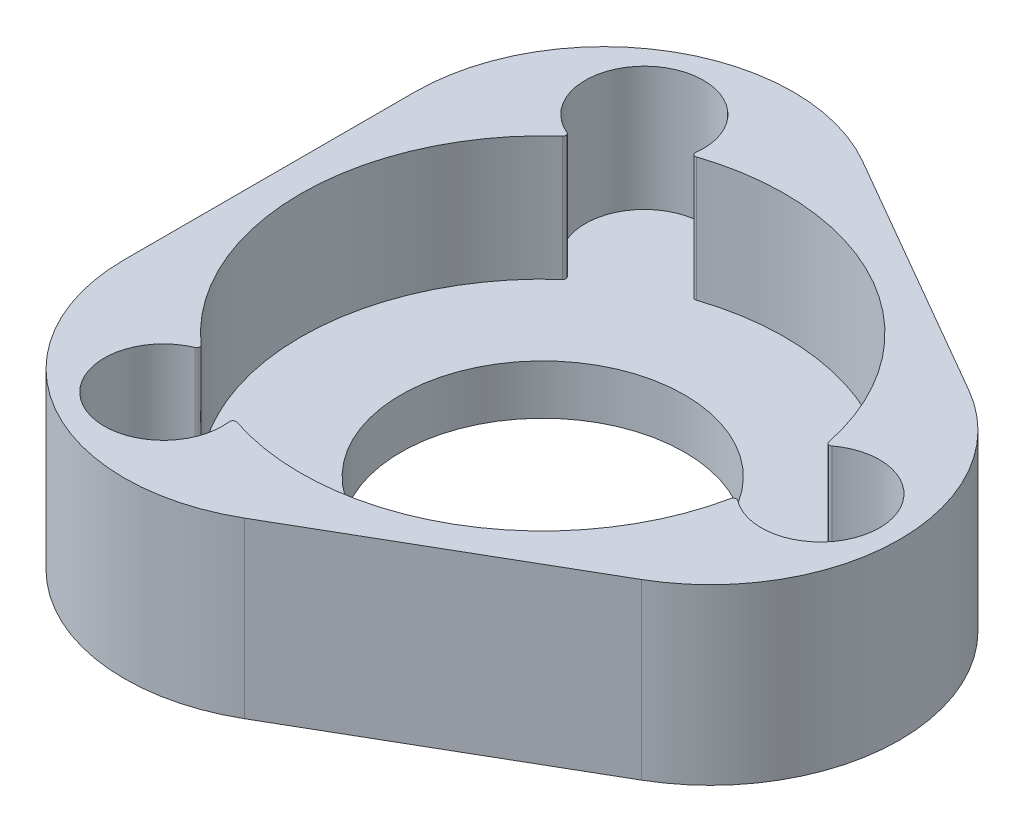
from build123d import *

# Parameters (mm, degrees)
BOSS_EXTRUDE15_DEPTH = 7
CUT_EXTRUDE1_DEPTH   = 5
SKETCH9_R            = 5.715
CUT_EXTRUDE2_DEPTH   = 5


with BuildPart() as part:
    # Sketch7 → Boss-Extrude15 (new body)
    with BuildSketch(Plane(origin=(0, 0, 0), x_dir=(1, 0, 0), z_dir=(0, 1, 0))):
        with BuildLine():
            Line((10.57, 6.599113577), (0.43, 12.453445306))
            ThreePointArc((0.43, 12.453445306), (-7.19, 12.453445306), (-11, 5.85433173))
            Line((-11, 5.85433173), (-11, -5.85433173))
            ThreePointArc((-11, -5.85433173), (-7.19, -12.453445306), (0.43, -12.453445306))
            Line((0.43, -12.453445306), (10.57, -6.599113577))
            ThreePointArc((10.57, -6.599113577), (14.38, 0), (10.57, 6.599113577))
        make_face()
    extrude(amount=BOSS_EXTRUDE15_DEPTH)

    # Sketch8 → Cut-Extrude1 (cut)
    with BuildSketch(Plane(origin=(0, 7, 0), x_dir=(1, 0, 0), z_dir=(0, 1, 0))):
        with BuildLine():
            ThreePointArc((-6.482578701, -7.282765504), (-6.441733645, -7.398430092), (-6.51776578, -7.494688754))
            ThreePointArc((-6.51776578, -7.494688754), (-7.970853819, -9.540441946), (-6.784903319, -11.751797273))
            ThreePointArc((-6.784903319, -11.751797273), (-4.276838179, -11.67318287), (-3.231707964, -9.391895118))
            ThreePointArc((-3.231707964, -9.391895118), (-3.186361585, -9.277920027), (-3.065770585, -9.255460589))
            ThreePointArc((-3.065770585, -9.255460589), (4.875, -8.443747687), (9.548349287, -1.972695086))
            ThreePointArc((9.548349287, -1.972695086), (9.62809523, -1.879489935), (9.749473744, -1.897206364))
            ThreePointArc((9.749473744, -1.897206364), (12.247691998, -2.132740924), (13.569806638, 0))
            ThreePointArc((13.569806638, 0), (12.247691998, 2.132740924), (9.749473744, 1.897206364))
            ThreePointArc((9.749473744, 1.897206364), (9.62809523, 1.879489935), (9.548349287, 1.972695086))
            ThreePointArc((9.548349287, 1.972695086), (4.875, 8.443747687), (-3.065770585, 9.255460589))
            ThreePointArc((-3.065770585, 9.255460589), (-3.186361585, 9.277920027), (-3.231707964, 9.391895118))
            ThreePointArc((-3.231707964, 9.391895118), (-4.276838179, 11.67318287), (-6.784903319, 11.751797273))
            ThreePointArc((-6.784903319, 11.751797273), (-7.970853819, 9.540441946), (-6.51776578, 7.494688754))
            ThreePointArc((-6.51776578, 7.494688754), (-6.441733645, 7.398430092), (-6.482578701, 7.282765504))
            ThreePointArc((-6.482578701, 7.282765504), (-9.75, 0), (-6.482578701, -7.282765504))
        make_face()
    extrude(amount=-CUT_EXTRUDE1_DEPTH, mode=Mode.SUBTRACT)

    # Sketch9 → Cut-Extrude2 (cut)
    with BuildSketch(Plane(origin=(0, 2, 0), x_dir=(1, 0, 0), z_dir=(0, 1, 0))):
        Circle(SKETCH9_R)
    extrude(amount=-CUT_EXTRUDE2_DEPTH, mode=Mode.SUBTRACT)


solid = part.part
